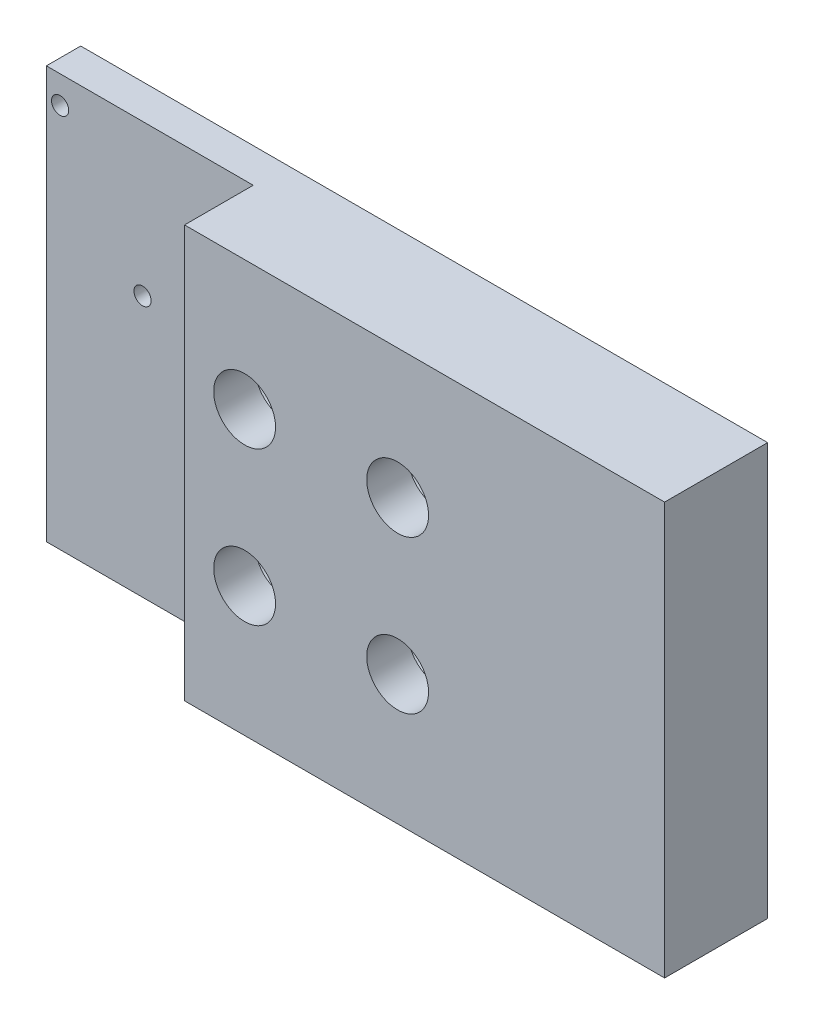
from build123d import *

# Parameters (mm, degrees)
SKETCH_1_W                = 100
SKETCH_1_H                = 60
EXTRUDE_1_DEPTH           = 15
HOLE_WIZARD_9_0_9_1_D     = 9
HOLE_WIZARD_9_0_9_1_DEPTH = 6
HOLE_WIZARD_9_0_9_1_TIP   = 2.703872786
HOLE_WIZARD_M5_2_D        = 4.2
SKETCH_8_W                = 30.11564459
SKETCH_8_H                = 60
CUT_EXTRUDE_2_DEPTH       = 10
HOLE_WIZARD_M3_1_D        = 2.5


with BuildPart() as part:
    # 스케치1 → 보스-돌출1 (new body)
    with BuildSketch(Plane.XY):
        Rectangle(SKETCH_1_W, SKETCH_1_H)
    extrude(amount=EXTRUDE_1_DEPTH)

    # Ø9.0 (9) 지름 구멍1
    with Locations(Plane(origin=(-11.136931804, 11.136931804, 15), x_dir=(1, 0, 0), z_dir=(0, 0, 1))):
        with Locations((0, 0), (22.273863608, 0), (0, -22.273863608), (22.273863608, -22.273863608)):
            Hole(HOLE_WIZARD_9_0_9_1_D / 2, depth=HOLE_WIZARD_9_0_9_1_DEPTH)
            with Locations((0, 0, -(HOLE_WIZARD_9_0_9_1_DEPTH + HOLE_WIZARD_9_0_9_1_TIP / 2))):  # 118° drill point
                Cone(0, HOLE_WIZARD_9_0_9_1_D / 2, HOLE_WIZARD_9_0_9_1_TIP, mode=Mode.SUBTRACT)

    # M5 나사 구멍2 (through all)
    with Locations(Plane.XY.offset(15)):
        with Locations((-11.136931804, 11.136931804), (11.136931804, 11.136931804), (11.136931804, -11.136931804), (-11.136931804, -11.136931804)):
            Hole(HOLE_WIZARD_M5_2_D / 2)

    # 스케치8 → 컷-돌출2 (cut)
    with BuildSketch(Plane.XY.offset(15)):
        with Locations((-34.942177705, 0)):
            Rectangle(SKETCH_8_W, SKETCH_8_H)
    extrude(amount=-CUT_EXTRUDE_2_DEPTH, mode=Mode.SUBTRACT)

    # M3 나사 구멍1 (through all)
    with Locations(Plane(origin=(-36, 8, 0), x_dir=(-1, 0, 0), z_dir=(0, 0, -1))):
        with Locations((0, 0), (12, 18)):
            Hole(HOLE_WIZARD_M3_1_D / 2)


solid = part.part
